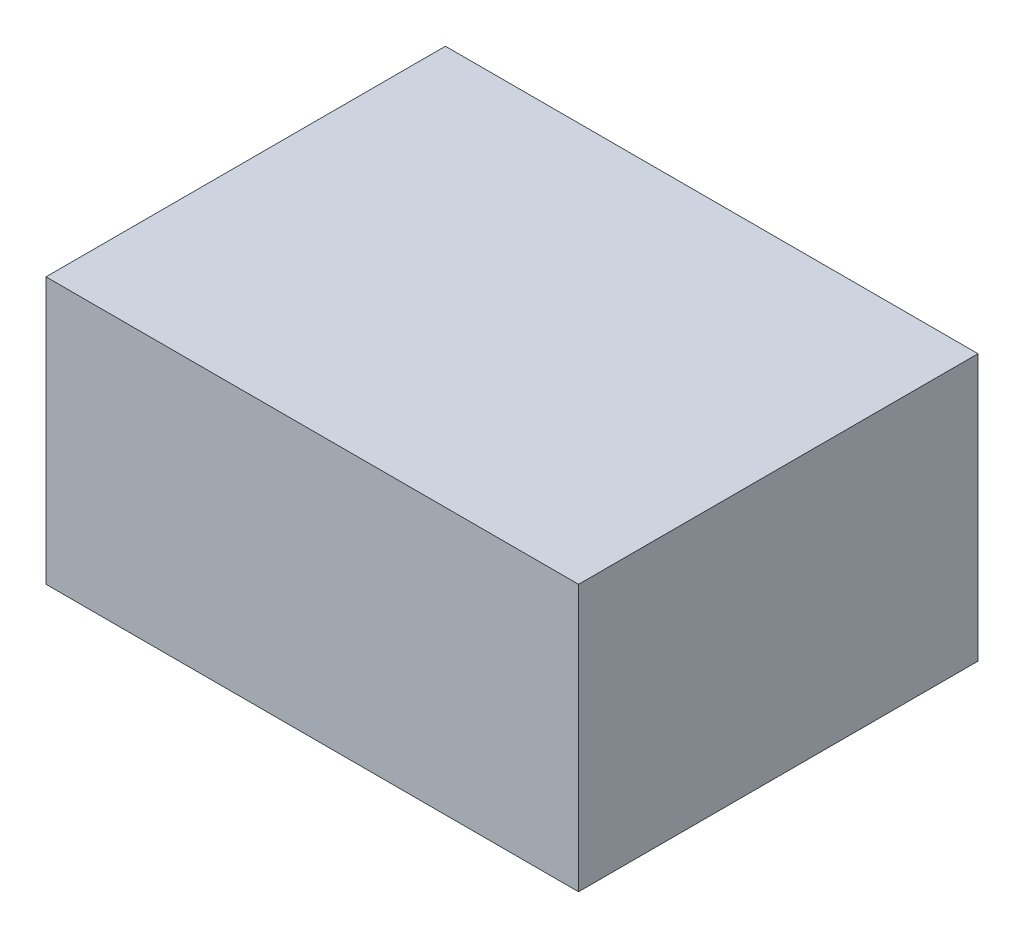
from build123d import *
from OCP.BRepFilletAPI import BRepFilletAPI_MakeChamfer

# Parameters (mm, degrees)
SKETCH1_W           = 60
SKETCH1_H           = 45
BOSS_EXTRUDE1_DEPTH = 30
SKETCH2_W           = 6.5
SKETCH2_H           = 16
CUT_EXTRUDE1_DEPTH  = 20
CHAMFER1_SIZE       = 5
CHAMFER1_SIZE2      = 0.437443318
CHAMFER2_SIZE       = 5
CHAMFER2_SIZE2      = 5.958767963
CUT_EXTRUDE2_DEPTH  = 10
CHAMFER3_SIZE       = 3
CHAMFER3_SIZE2      = 2


with BuildPart() as part:
    # Sketch1 → Boss-Extrude1 (new body)
    with BuildSketch(Plane(origin=(0, 0, 0), x_dir=(1, 0, 0), z_dir=(0, 1, 0))):
        with Locations((-30, 22.5)):
            Rectangle(SKETCH1_W, SKETCH1_H)
    extrude(amount=BOSS_EXTRUDE1_DEPTH)

    # Sketch2 → Cut-Extrude1 (cut)
    with BuildSketch(Plane(origin=(0, 0, 0), x_dir=(-1, 0, 0), z_dir=(0, -1, 0))):
        with Locations((47.75, 21)):
            Rectangle(SKETCH2_W, SKETCH2_H)
        with Locations((12.75, 21)):
            Rectangle(SKETCH2_W, SKETCH2_H)
    extrude(amount=-CUT_EXTRUDE1_DEPTH, mode=Mode.SUBTRACT)

    # Chamfer1: one chamfer whose edges measure the first distance from different faces: ONE call of the kernel's chamfer builder (chamfer() names one face for all edges)
    chamfer1_edges_1 = [part.edges().sort_by_distance(p)[0] for p in [
        (-51, 20, -21),
    ]]
    chamfer1_side_1 = [part.faces().sort_by_distance(p)[0] for p in [
        (-51, 10, -21),
    ]]
    chamfer1_edges_2 = [part.edges().sort_by_distance(p)[0] for p in [
        (-44.5, 20, -21),
    ]]
    chamfer1_side_2 = [part.faces().sort_by_distance(p)[0] for p in [
        (-44.5, 10, -21),
    ]]
    chamfer1_edges_3 = [part.edges().sort_by_distance(p)[0] for p in [
        (-16, 20, -21),
    ]]
    chamfer1_side_3 = [part.faces().sort_by_distance(p)[0] for p in [
        (-16, 10, -21),
    ]]
    chamfer1_edges_4 = [part.edges().sort_by_distance(p)[0] for p in [
        (-9.5, 20, -21),
    ]]
    chamfer1_side_4 = [part.faces().sort_by_distance(p)[0] for p in [
        (-9.5, 10, -21),
    ]]
    chamfer1 = BRepFilletAPI_MakeChamfer(part.part.solid().wrapped)
    for e in chamfer1_edges_1:
        chamfer1.Add(CHAMFER1_SIZE, CHAMFER1_SIZE2, e.wrapped, chamfer1_side_1[0].wrapped)  # the first distance lies on this face
    for e in chamfer1_edges_2:
        chamfer1.Add(CHAMFER1_SIZE, CHAMFER1_SIZE2, e.wrapped, chamfer1_side_2[0].wrapped)  # the first distance lies on this face
    for e in chamfer1_edges_3:
        chamfer1.Add(CHAMFER1_SIZE, CHAMFER1_SIZE2, e.wrapped, chamfer1_side_3[0].wrapped)  # the first distance lies on this face
    for e in chamfer1_edges_4:
        chamfer1.Add(CHAMFER1_SIZE, CHAMFER1_SIZE2, e.wrapped, chamfer1_side_4[0].wrapped)  # the first distance lies on this face
    add(Compound.cast(chamfer1.Shape()), mode=Mode.REPLACE)

    # Chamfer2: one chamfer whose edges measure the first distance from different faces: ONE call of the kernel's chamfer builder (chamfer() names one face for all edges)
    chamfer2_edges_1 = [part.edges().sort_by_distance(p)[0] for p in [
        (-47.75, 20, -29),
    ]]
    chamfer2_side_1 = [part.faces().sort_by_distance(p)[0] for p in [
        (-47.75, 9.857394508, -29),
    ]]
    chamfer2_edges_2 = [part.edges().sort_by_distance(p)[0] for p in [
        (-12.75, 20, -29),
    ]]
    chamfer2_side_2 = [part.faces().sort_by_distance(p)[0] for p in [
        (-12.75, 9.857394508, -29),
    ]]
    chamfer2_edges_3 = [part.edges().sort_by_distance(p)[0] for p in [
        (-12.75, 20, -13),
    ]]
    chamfer2_side_3 = [part.faces().sort_by_distance(p)[0] for p in [
        (-12.75, 9.857394508, -13),
    ]]
    chamfer2_edges_4 = [part.edges().sort_by_distance(p)[0] for p in [
        (-47.75, 20, -13),
    ]]
    chamfer2_side_4 = [part.faces().sort_by_distance(p)[0] for p in [
        (-47.75, 9.857394508, -13),
    ]]
    chamfer2 = BRepFilletAPI_MakeChamfer(part.part.solid().wrapped)
    for e in chamfer2_edges_1:
        chamfer2.Add(CHAMFER2_SIZE, CHAMFER2_SIZE2, e.wrapped, chamfer2_side_1[0].wrapped)  # the first distance lies on this face
    for e in chamfer2_edges_2:
        chamfer2.Add(CHAMFER2_SIZE, CHAMFER2_SIZE2, e.wrapped, chamfer2_side_2[0].wrapped)  # the first distance lies on this face
    for e in chamfer2_edges_3:
        chamfer2.Add(CHAMFER2_SIZE, CHAMFER2_SIZE2, e.wrapped, chamfer2_side_3[0].wrapped)  # the first distance lies on this face
    for e in chamfer2_edges_4:
        chamfer2.Add(CHAMFER2_SIZE, CHAMFER2_SIZE2, e.wrapped, chamfer2_side_4[0].wrapped)  # the first distance lies on this face
    add(Compound.cast(chamfer2.Shape()), mode=Mode.REPLACE)

    # Sketch4 → Cut-Extrude2 (cut)
    with BuildSketch(Plane(origin=(0, 0, -45), x_dir=(-1, 0, 0), z_dir=(0, 0, -1))):
        with BuildLine():
            Line((12.7, 0), (29.5, 0))
            ThreePointArc((29.5, 0), (35.280602383, 6.276082414), (43.81191296, 6.13008847))
            ThreePointArc((43.81191296, 6.13008847), (48.288831578, 7.478397416), (47.430644896, 12.074510224))
            ThreePointArc((47.430644896, 12.074510224), (26.808734298, 15.404376803), (12.7, 0))
        make_face()
    extrude(amount=-CUT_EXTRUDE2_DEPTH, mode=Mode.SUBTRACT)

    # Chamfer3
    chamfer3_edges = [part.edges().sort_by_distance(p)[0] for p in [
        (-51, 0, -21),
        (-47.75, 0, -29),
        (-44.5, 0, -21),
        (-47.75, 0, -13),
        (-16, 0, -21),
        (-12.75, 0, -29),
        (-9.5, 0, -21),
        (-12.75, 0, -13),
    ]]
    chamfer3_side = [part.faces().sort_by_distance(p)[0] for p in [
        (-30.620998279, 0, -21.36919105),
    ]]
    chamfer(chamfer3_edges, length=CHAMFER3_SIZE, length2=CHAMFER3_SIZE2, reference=chamfer3_side[0])


solid = part.part
